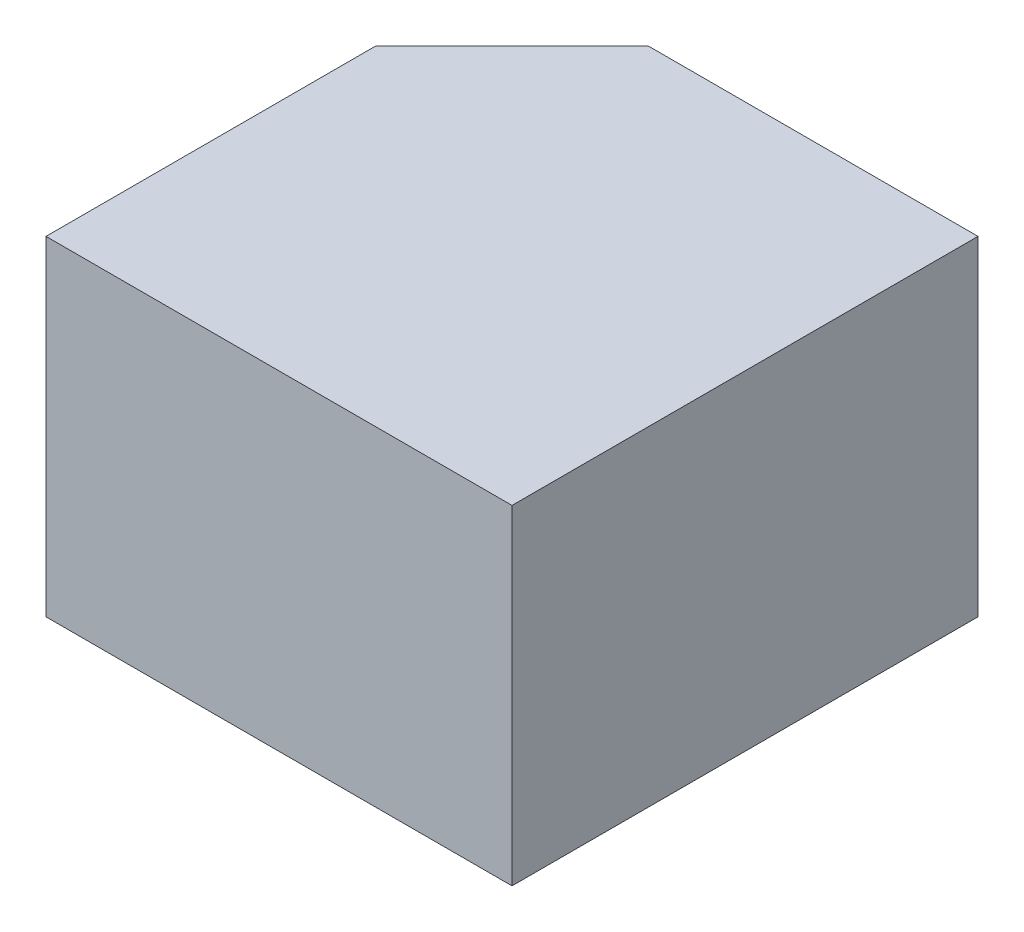
from build123d import *

# Parameters (mm, degrees)
SKETCH6_W           = 42.426406872
SKETCH6_H           = 42.426406872
BOSS_EXTRUDE4_DEPTH = 30
CUT_EXTRUDE2_DEPTH  = 43.426406871


with BuildPart() as part:
    # Sketch6 → Boss-Extrude4 (new body)
    with BuildSketch(Plane(origin=(0, 0, 0), x_dir=(1, 0, 0), z_dir=(0, 1, 0))):
        Rectangle(SKETCH6_W, SKETCH6_H)
    extrude(amount=BOSS_EXTRUDE4_DEPTH)

    # Sketch7 → Cut-Extrude2 (cut, through all)
    with BuildSketch(Plane.XZ):
        Polygon((-21.213203436, -8.786796564), (-8.786796564, -21.213203436), (-21.213203436, -21.213203436), align=None)
    extrude(amount=-CUT_EXTRUDE2_DEPTH, mode=Mode.SUBTRACT)


solid = part.part
